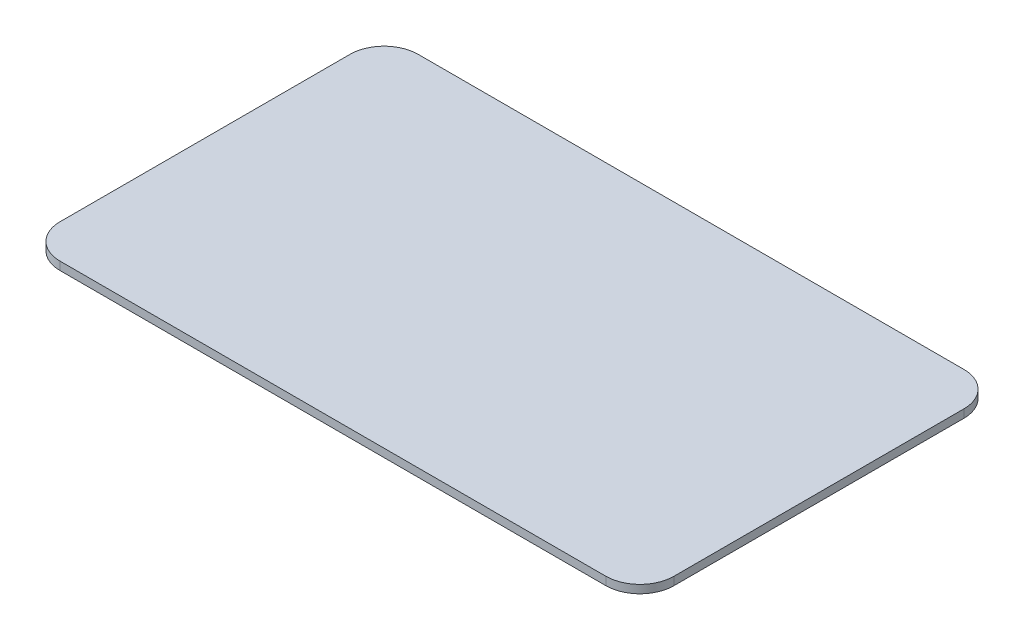
from build123d import *

# Parameters (mm, degrees)
SKETCH1_W           = 114.3
SKETCH1_H           = 66.675
BOSS_EXTRUDE1_DEPTH = 1.524
FILLET1_R           = 6.35


with BuildPart() as part:
    # Sketch1 → Boss-Extrude1 (new body)
    with BuildSketch(Plane(origin=(0, 0, 0), x_dir=(1, 0, 0), z_dir=(0, 1, 0))):
        Rectangle(SKETCH1_W, SKETCH1_H)
    extrude(amount=BOSS_EXTRUDE1_DEPTH)

    # Fillet1
    fillet1_edges = [part.edges().sort_by_distance(p)[0] for p in [
        (-57.15, 0.762, -33.3375),
        (57.15, 0.762, -33.3375),
        (57.15, 0.762, 33.3375),
        (-57.15, 0.762, 33.3375),
    ]]
    fillet(fillet1_edges, radius=FILLET1_R)


solid = part.part
